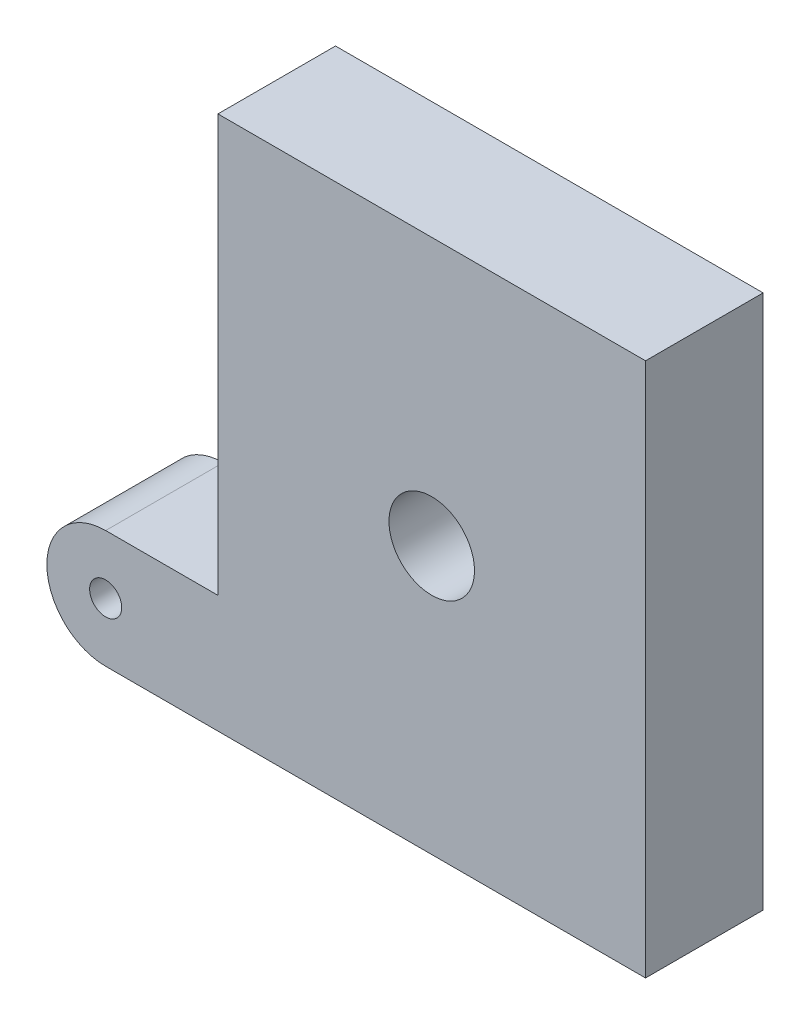
from build123d import *

# Parameters (mm, degrees)
BOSS_EXTRU_1_DEPTH      = 22
ESQUISSE1_8_R           = 8
ENL_V_MAT_EXTRU_1_DEPTH = 22
ESQUISSE1_9_R           = 3
ENL_V_MAT_EXTRU_2_DEPTH = 22


with BuildPart() as part:
    # Esquisse1 → Boss.-Extru.1 (new body)
    with BuildSketch(Plane.XY):
        with BuildLine():
            Line((50.5, 50), (-29.5, 50))
            Line((-29.5, 50), (-29.5, -28))
            Line((-29.5, -28), (-50.5, -28))
            ThreePointArc((-50.5, -28), (-61.5, -39), (-50.5, -50))
            Line((-50.5, -50), (50.5, -50))
            Line((50.5, -50), (50.5, 50))
        make_face()
    extrude(amount=BOSS_EXTRU_1_DEPTH)

    # Esquisse1<8> → Enlèv. mat.-Extru.1 (cut)
    with BuildSketch(Plane.XY):
        with Locations((10.5, 0)):
            Circle(ESQUISSE1_8_R)
    extrude(amount=ENL_V_MAT_EXTRU_1_DEPTH, mode=Mode.SUBTRACT)

    # Esquisse1<9> → Enlèv. mat.-Extru.2 (cut)
    with BuildSketch(Plane.XY):
        with Locations((-50.5, -39)):
            Circle(ESQUISSE1_9_R)
    extrude(amount=ENL_V_MAT_EXTRU_2_DEPTH, mode=Mode.SUBTRACT)


solid = part.part
